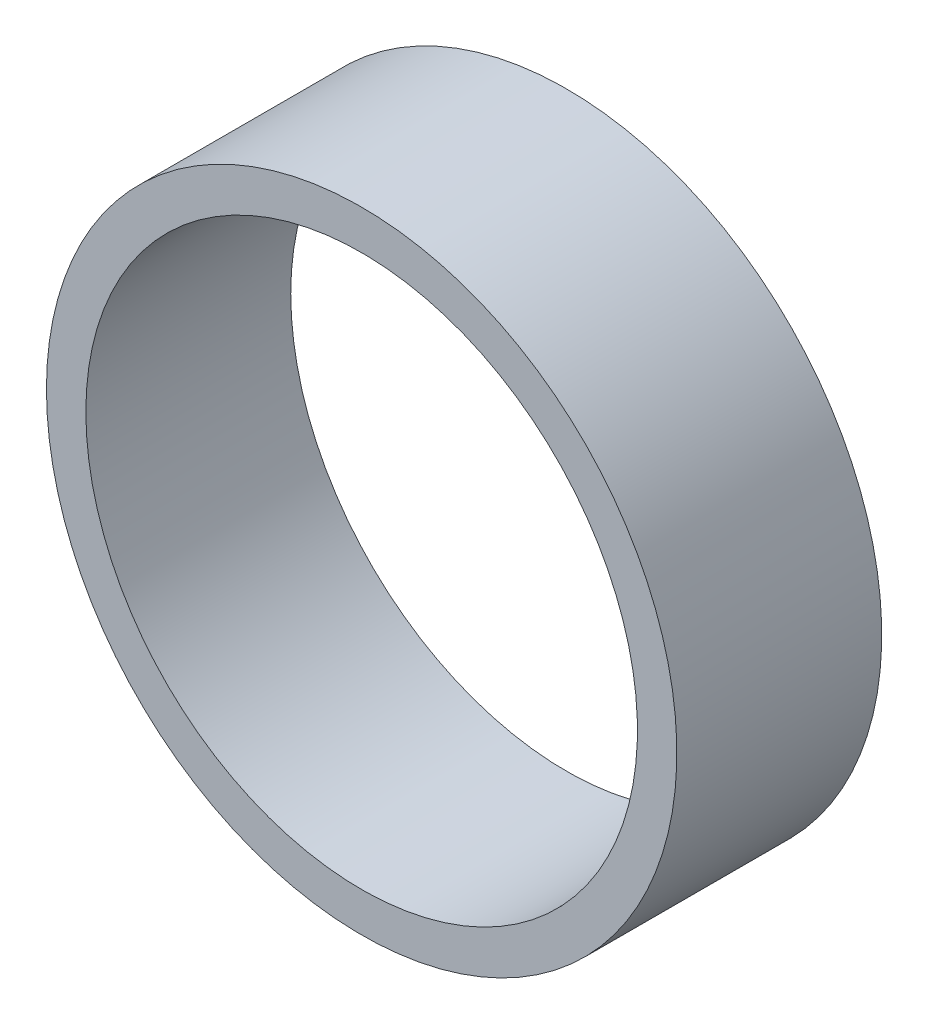
from build123d import *

# Parameters (mm, degrees)
SKETCH_1_R      = 20
SKETCH_1_R_2    = 17.5
EXTRUDE_1_DEPTH = 13


with BuildPart() as part:
    # 草图1 → 凸台-拉伸1 (new body)
    with BuildSketch(Plane.XY):
        with Locations(Location((0, 0, 0), (0, 0, 180))):
            Circle(SKETCH_1_R)
        with Locations(Location((0, 0, 0), (0, 0, 180))):
            Circle(SKETCH_1_R_2, mode=Mode.SUBTRACT)
    extrude(amount=EXTRUDE_1_DEPTH)


solid = part.part
